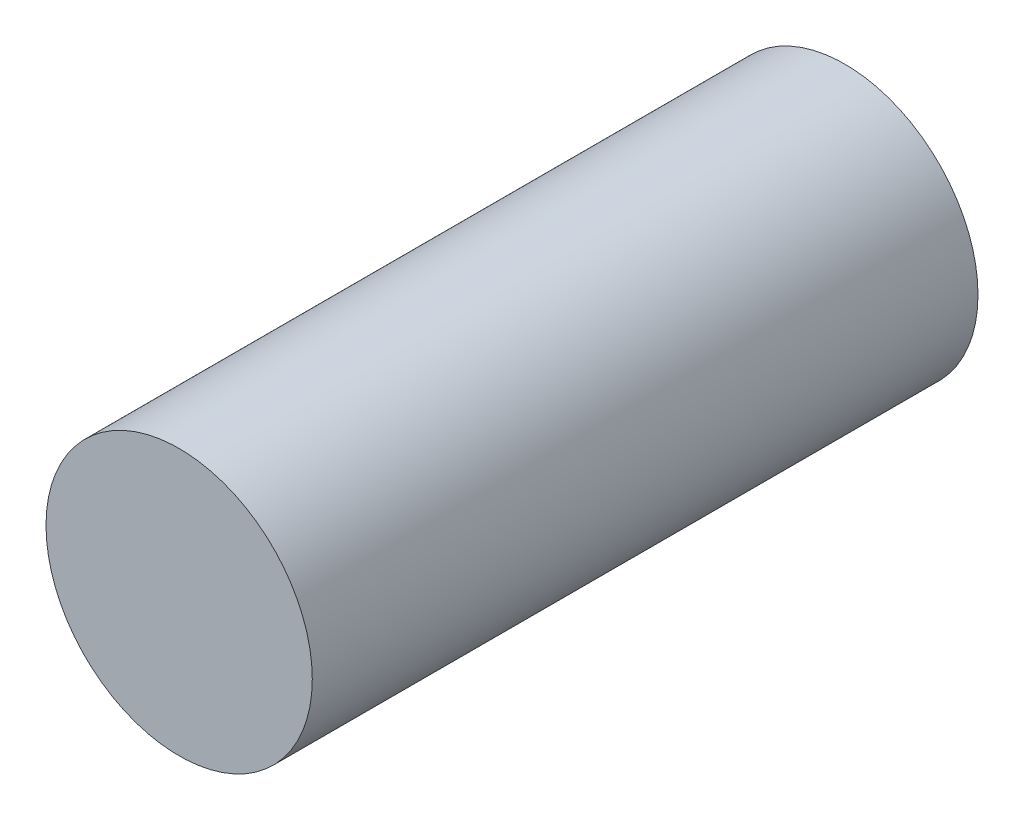
from build123d import *

# Parameters (mm, degrees)
CROQUIS1_R              = 6
SALIENTE_EXTRUIR1_DEPTH = 30


with BuildPart() as part:
    # Croquis1 → Saliente-Extruir1 (new body)
    with BuildSketch(Plane.XY):
        Circle(CROQUIS1_R)
    extrude(amount=SALIENTE_EXTRUIR1_DEPTH)


solid = part.part
